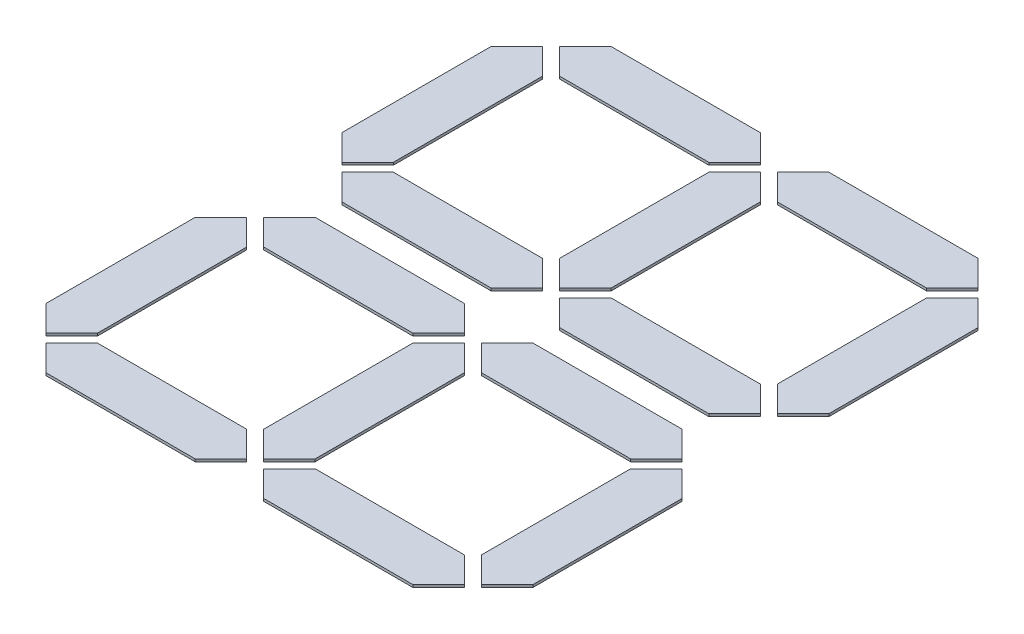
from build123d import *

# Parameters (mm, degrees)
RESSALTO_EXTRUS_O1_DEPTH    = 2
RESSALTO_EXTRUS_O1_2_DEPTH  = 2
RESSALTO_EXTRUS_O1_3_DEPTH  = 2
RESSALTO_EXTRUS_O1_4_DEPTH  = 2
RESSALTO_EXTRUS_O1_5_DEPTH  = 2
RESSALTO_EXTRUS_O1_6_DEPTH  = 2
RESSALTO_EXTRUS_O1_7_DEPTH  = 2
RESSALTO_EXTRUS_O1_8_DEPTH  = 2
RESSALTO_EXTRUS_O1_9_DEPTH  = 2
RESSALTO_EXTRUS_O1_10_DEPTH = 2
RESSALTO_EXTRUS_O1_11_DEPTH = 2
RESSALTO_EXTRUS_O1_12_DEPTH = 2
RESSALTO_EXTRUS_O1_13_DEPTH = 2
RESSALTO_EXTRUS_O1_14_DEPTH = 2


with BuildPart() as part:
    # Esboço1 → Ressalto-extrusão1 (new body)
    with BuildSketch(Plane(origin=(0, 6.8, 0), x_dir=(1, 0, 0), z_dir=(0, 1, 0))):
        Polygon((-165.173134603, 288.671451709), (-144.923134603, 308.921451709), (-144.923134603, 426.371451709), (-165.173134603, 446.621451709), (-185.423134603, 426.371451709), (-185.423134603, 308.921451709), align=None)
    extrude(amount=RESSALTO_EXTRUS_O1_DEPTH)


with BuildPart() as body_2:
    # Esboço1 → Ressalto-extrus_o1 2 (new body)
    with BuildSketch(Plane(origin=(0, 6.8, 0), x_dir=(1, 0, 0), z_dir=(0, 1, 0))):
        Polygon((-309.623134603, 261.671451709), (-192.173134603, 261.671451709), (-171.923134603, 281.921451709), (-192.173134603, 302.171451709), (-309.623134603, 302.171451709), (-329.873134603, 281.921451709), align=None)
    extrude(amount=RESSALTO_EXTRUS_O1_2_DEPTH)


with BuildPart() as body_3:
    # Esboço1 → Ressalto-extrus_o1 3 (new body)
    with BuildSketch(Plane(origin=(0, 6.8, 0), x_dir=(1, 0, 0), z_dir=(0, 1, 0))):
        Polygon((-192.173134603, 473.621451709), (-309.623134603, 473.621451709), (-329.873134603, 453.371451709), (-309.623134603, 433.121451709), (-192.173134603, 433.121451709), (-171.923134603, 453.371451709), align=None)
    extrude(amount=RESSALTO_EXTRUS_O1_3_DEPTH)


with BuildPart() as body_4:
    # Esboço1 → Ressalto-extrus_o1 4 (new body)
    with BuildSketch(Plane(origin=(0, 6.8, 0), x_dir=(1, 0, 0), z_dir=(0, 1, 0))):
        Polygon((-336.623134603, 446.621451709), (-356.873134603, 426.371451709), (-356.873134603, 308.921451709), (-336.623134603, 288.671451709), (-316.373134603, 308.921451709), (-316.373134603, 426.371451709), align=None)
    extrude(amount=RESSALTO_EXTRUS_O1_4_DEPTH)


with BuildPart() as body_5:
    # Esboço1 → Ressalto-extrus_o1 5 (new body)
    with BuildSketch(Plane(origin=(0, 6.8, 0), x_dir=(1, 0, 0), z_dir=(0, 1, 0))):
        Polygon((-0.473134603, 453.371451709), (-20.723134603, 473.621451709), (-138.173134603, 473.621451709), (-158.423134603, 453.371451709), (-138.173134603, 433.121451709), (-20.723134603, 433.121451709), align=None)
    extrude(amount=RESSALTO_EXTRUS_O1_5_DEPTH)


with BuildPart() as body_6:
    # Esboço1 → Ressalto-extrus_o1 6 (new body)
    with BuildSketch(Plane(origin=(0, 6.8, 0), x_dir=(1, 0, 0), z_dir=(0, 1, 0))):
        Polygon((26.526865397, 308.921451709), (26.526865397, 426.371451709), (6.276865397, 446.621451709), (-13.973134603, 426.371451709), (-13.973134603, 308.921451709), (6.276865397, 288.671451709), align=None)
    extrude(amount=RESSALTO_EXTRUS_O1_6_DEPTH)


with BuildPart() as body_7:
    # Esboço1 → Ressalto-extrus_o1 7 (new body)
    with BuildSketch(Plane(origin=(0, 6.8, 0), x_dir=(1, 0, 0), z_dir=(0, 1, 0))):
        Polygon((-20.723134603, 261.671451709), (-0.473134603, 281.921451709), (-20.723134603, 302.171451709), (-138.173134603, 302.171451709), (-158.423134603, 281.921451709), (-138.173134603, 261.671451709), align=None)
    extrude(amount=RESSALTO_EXTRUS_O1_7_DEPTH)


with BuildPart() as body_8:
    # Esboço1 → Ressalto-extrus_o1 8 (new body)
    with BuildSketch(Plane(origin=(0, 6.8, 0), x_dir=(1, 0, 0), z_dir=(0, 1, 0))):
        Polygon((-165.173134603, 55.671451709), (-144.923134603, 75.921451709), (-144.923134603, 193.371451709), (-165.173134603, 213.621451709), (-185.423134603, 193.371451709), (-185.423134603, 75.921451709), align=None)
    extrude(amount=RESSALTO_EXTRUS_O1_8_DEPTH)


with BuildPart() as body_9:
    # Esboço1 → Ressalto-extrus_o1 9 (new body)
    with BuildSketch(Plane(origin=(0, 6.8, 0), x_dir=(1, 0, 0), z_dir=(0, 1, 0))):
        Polygon((-309.623134603, 28.671451709), (-192.173134603, 28.671451709), (-171.923134603, 48.921451709), (-192.173134603, 69.171451709), (-309.623134603, 69.171451709), (-329.873134603, 48.921451709), align=None)
    extrude(amount=RESSALTO_EXTRUS_O1_9_DEPTH)


with BuildPart() as body_10:
    # Esboço1 → Ressalto-extrus_o1 10 (new body)
    with BuildSketch(Plane(origin=(0, 6.8, 0), x_dir=(1, 0, 0), z_dir=(0, 1, 0))):
        Polygon((-192.173134603, 240.621451709), (-309.623134603, 240.621451709), (-329.873134603, 220.371451709), (-309.623134603, 200.121451709), (-192.173134603, 200.121451709), (-171.923134603, 220.371451709), align=None)
    extrude(amount=RESSALTO_EXTRUS_O1_10_DEPTH)


with BuildPart() as body_11:
    # Esboço1 → Ressalto-extrus_o1 11 (new body)
    with BuildSketch(Plane(origin=(0, 6.8, 0), x_dir=(1, 0, 0), z_dir=(0, 1, 0))):
        Polygon((-336.623134603, 213.621451709), (-356.873134603, 193.371451709), (-356.873134603, 75.921451709), (-336.623134603, 55.671451709), (-316.373134603, 75.921451709), (-316.373134603, 193.371451709), align=None)
    extrude(amount=RESSALTO_EXTRUS_O1_11_DEPTH)


with BuildPart() as body_12:
    # Esboço1 → Ressalto-extrus_o1 12 (new body)
    with BuildSketch(Plane(origin=(0, 6.8, 0), x_dir=(1, 0, 0), z_dir=(0, 1, 0))):
        Polygon((-0.473134603, 220.371451709), (-20.723134603, 240.621451709), (-138.173134603, 240.621451709), (-158.423134603, 220.371451709), (-138.173134603, 200.121451709), (-20.723134603, 200.121451709), align=None)
    extrude(amount=RESSALTO_EXTRUS_O1_12_DEPTH)


with BuildPart() as body_13:
    # Esboço1 → Ressalto-extrus_o1 13 (new body)
    with BuildSketch(Plane(origin=(0, 6.8, 0), x_dir=(1, 0, 0), z_dir=(0, 1, 0))):
        Polygon((26.526865397, 75.921451709), (26.526865397, 193.371451709), (6.276865397, 213.621451709), (-13.973134603, 193.371451709), (-13.973134603, 75.921451709), (6.276865397, 55.671451709), align=None)
    extrude(amount=RESSALTO_EXTRUS_O1_13_DEPTH)


with BuildPart() as body_14:
    # Esboço1 → Ressalto-extrus_o1 14 (new body)
    with BuildSketch(Plane(origin=(0, 6.8, 0), x_dir=(1, 0, 0), z_dir=(0, 1, 0))):
        Polygon((-20.723134603, 28.671451709), (-0.473134603, 48.921451709), (-20.723134603, 69.171451709), (-138.173134603, 69.171451709), (-158.423134603, 48.921451709), (-138.173134603, 28.671451709), align=None)
    extrude(amount=RESSALTO_EXTRUS_O1_14_DEPTH)


solid = Compound([part.part, body_2.part, body_3.part, body_4.part, body_5.part, body_6.part, body_7.part, body_8.part, body_9.part, body_10.part, body_11.part, body_12.part, body_13.part, body_14.part])
